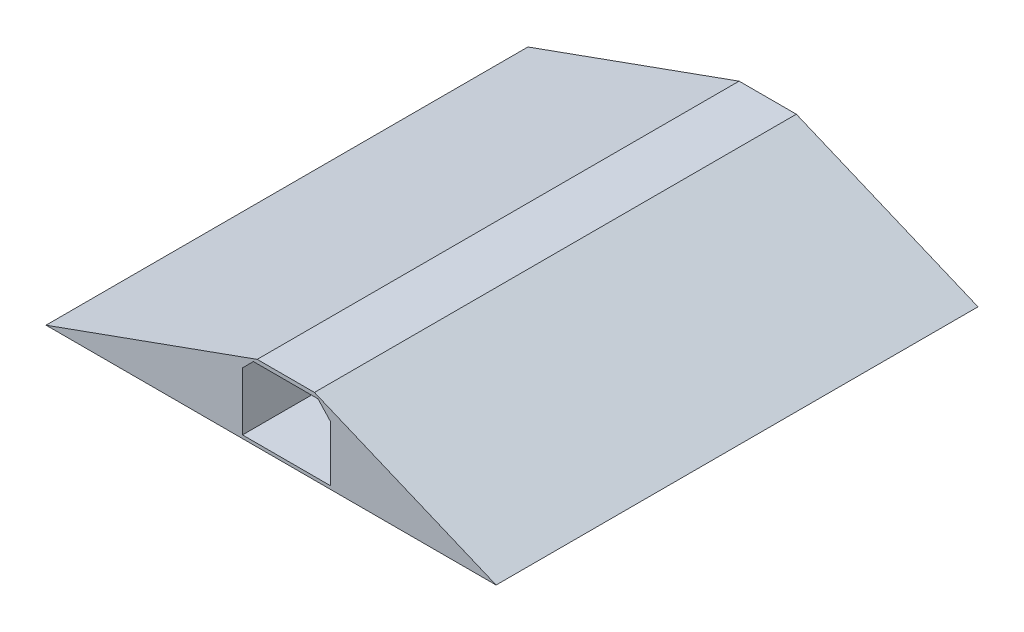
from build123d import *

# Parameters (mm, degrees)
SALIENTE_EXTRUIR1_DEPTH = 55
CORTAR_EXTRUIR1_DEPTH   = 68


with BuildPart() as part:
    # Croquis1 → Saliente-Extruir1 (new body)
    with BuildSketch(Plane.XY):
        Polygon((-7.08566541, -21.054004681), (20.287395509, -21.054004681), (-0.444607291, -12.379909579), (-6.980601691, -12.379909579), (-31.08566541, -21.054004681), align=None)
    extrude(amount=SALIENTE_EXTRUIR1_DEPTH)

    # Croquis2 → Cortar-Extruir1 (cut)
    with BuildSketch(Plane.XY):
        Polygon((-7.413108938, -12.812416826), (-0.041425498, -12.812416826), (1.379269414, -14.336446074), (1.379269414, -20.687882008), (-8.657749406, -20.687882008), (-8.657749406, -14.057057294), align=None)
    extrude(amount=CORTAR_EXTRUIR1_DEPTH, mode=Mode.SUBTRACT)


solid = part.part
